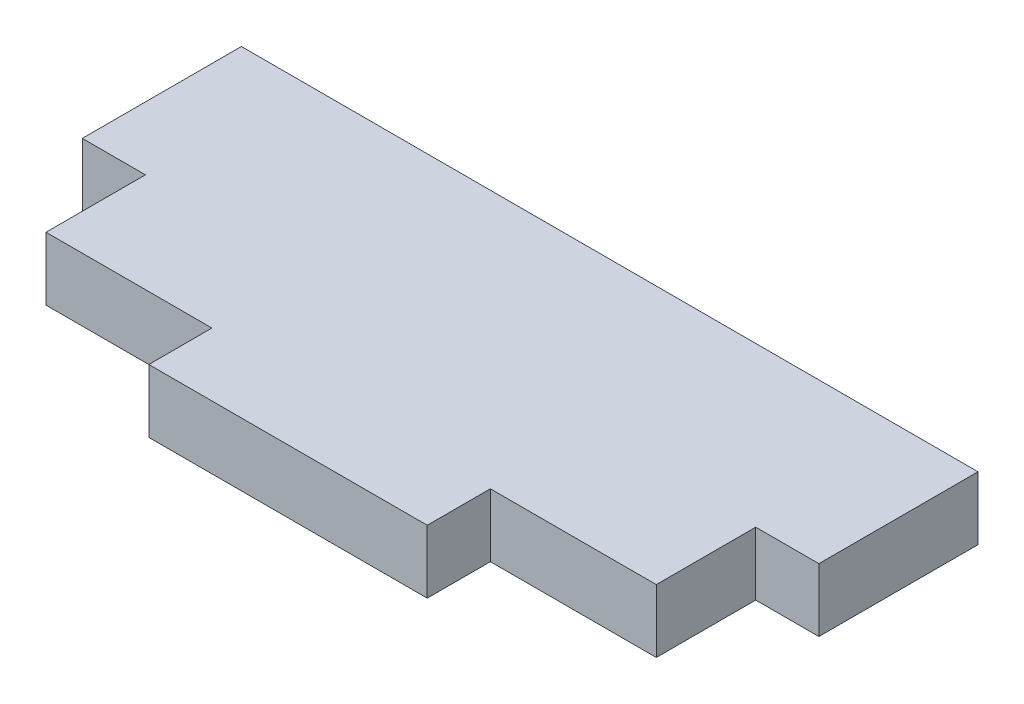
from build123d import *

# Parameters (mm, degrees)
SKETCH1_W           = 3.175
SKETCH1_H           = 8
SKETCH1_W_2         = 30.6846
SKETCH1_H_2         = 29.73
BOSS_EXTRUDE1_DEPTH = 3.175
SKETCH2_W           = 14
SKETCH2_H           = 3.175
BOSS_EXTRUDE5_DEPTH = 3.175
SKETCH3_W           = 3.175
SKETCH3_H           = 8
SKETCH3_W_2         = 5.123924413
SKETCH3_H_2         = 0.857075887
CUT_EXTRUDE1_DEPTH  = 3.175


with BuildPart() as part:
    # Sketch1 → Boss-Extrude1 (new body)
    with BuildSketch(Plane(origin=(0, 0, 0), x_dir=(1, 0, 0), z_dir=(0, 1, 0))):
        with Locations((-16.9298, 5.865)):
            Rectangle(SKETCH1_W, SKETCH1_H)
        Rectangle(SKETCH1_W_2, SKETCH1_H_2)
        with Locations((16.9298, -5.865)):
            Rectangle(SKETCH1_W, SKETCH1_H)
        with Locations((16.9298, 5.865)):
            Rectangle(SKETCH1_W, SKETCH1_H)
        with Locations((-16.9298, -5.865)):
            Rectangle(SKETCH1_W, SKETCH1_H)
    extrude(amount=BOSS_EXTRUDE1_DEPTH)

    # Sketch2 → Boss-Extrude5 (add)
    with BuildSketch(Plane.XY.offset(14.865)):
        with Locations((0, 1.5875)):
            Rectangle(SKETCH2_W, SKETCH2_H)
    extrude(amount=BOSS_EXTRUDE5_DEPTH)

    # Sketch3 → Cut-Extrude1 (cut)
    with BuildSketch(Plane(origin=(0, 3.175, 0), x_dir=(1, 0, 0), z_dir=(0, 1, 0))):
        Polygon((-18.5173, -1.865), (-15.3423, -1.865), (-15.3423, 1.865), (-18.5173, 1.865), (-18.5173, 9.865), (-15.3423, 9.865), (-15.3423, 14.865), (-15.3423, 15.722075887), (-23.299658128, 15.722075887), (-23.299658128, -1.865), align=None)
        Polygon((-15.3423, 1.865), (-15.3423, -1.865), (-10.218375587, -1.865), (-10.218375587, 14.865), (-15.3423, 14.865), (-15.3423, 9.865), align=None)
        Polygon((-10.218375587, 14.865), (-10.218375587, -1.865), (15.3423, -1.865), (15.3423, 1.865), (18.5173, 1.865), (18.5173, 9.865), (15.3423, 9.865), (15.3423, 14.865), align=None)
        Polygon((15.3423, 1.865), (15.3423, -1.865), (18.5173, -1.865), (22.154495347, -1.865), (22.154495347, 15.722075887), (-10.218375587, 15.722075887), (-10.218375587, 14.865), (15.3423, 14.865), (15.3423, 9.865), (18.5173, 9.865), (18.5173, 1.865), align=None)
        with Locations((-16.9298, 5.865)):
            Rectangle(SKETCH3_W, SKETCH3_H)
        with Locations((-12.780337794, 15.293537944)):
            Rectangle(SKETCH3_W_2, SKETCH3_H_2)
    extrude(amount=-CUT_EXTRUDE1_DEPTH, mode=Mode.SUBTRACT)


solid = part.part
